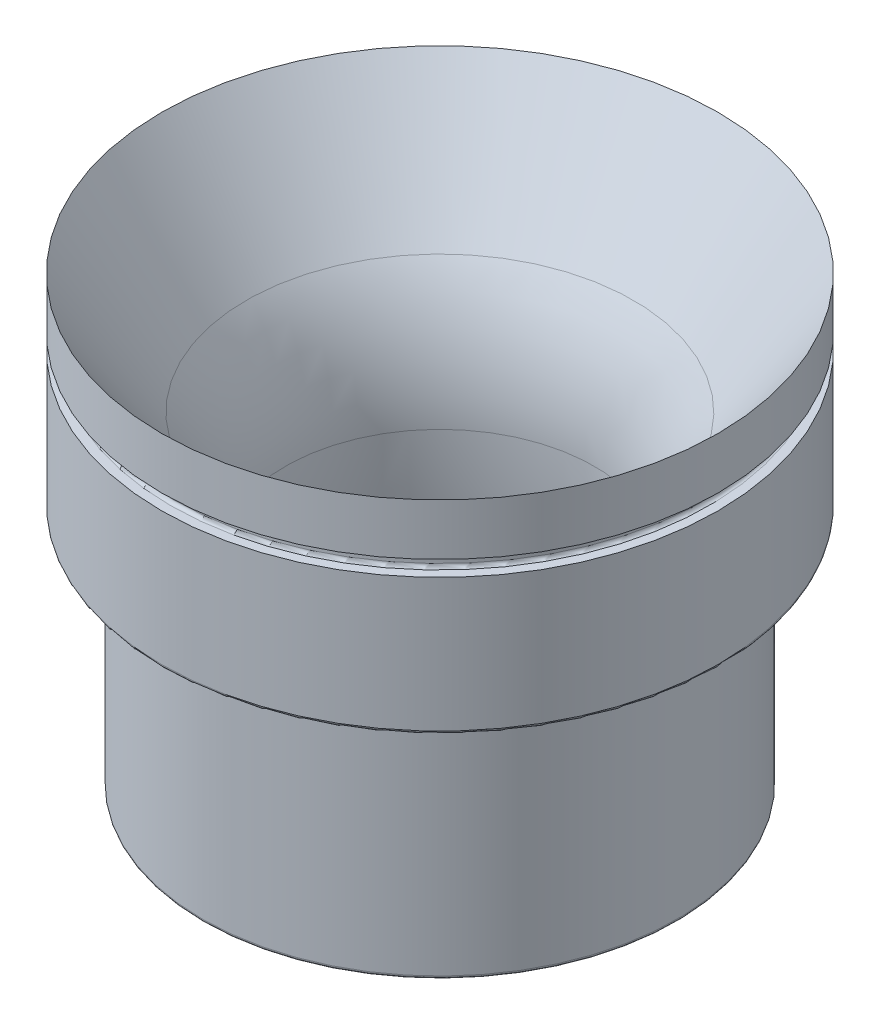
from build123d import *

# Parameters (mm, degrees)
SKETCH6_W     = 1.51765
SKETCH6_H     = 1.905
TOOL_RADIUS_R = 0.4064


with BuildPart() as part:
    # Sketch4 → Revolve1 (revolve)
    with BuildSketch(Plane(origin=(0, 0, 0), x_dir=(0, 0, -1), z_dir=(1, 0, 0)), mode=Mode.PRIVATE) as revolve1_sk:
        with BuildLine():
            Line((34.28365, 0), (23.873214979, -14.867642025))
            ThreePointArc((23.873214979, -14.867642025), (20.284368924, -22.14510191), (19.05, -30.164925582))
            ThreePointArc((19.05, -30.164925582), (19.864190646, -42.592331251), (22.292843289, -54.80727965))
            Line((22.292843289, -54.80727965), (29.1846, -54.80727965))
            Line((29.1846, -54.80727965), (29.1846, -25.059525582))
            Line((29.1846, -25.059525582), (34.28365, -25.059525582))
            Line((34.28365, -25.059525582), (34.28365, 0))
        make_face()
    revolve(revolve1_sk.sketch.rotate(Axis((0, 0, 0), (0, -1, 0)), 180), axis=Axis((0, 0, 0), (0, -1, 0)))

    # Sketch6 → Spring Groove (revolve, cut)
    with BuildSketch(Plane(origin=(0, 0, 0), x_dir=(0, 0, -1), z_dir=(1, 0, 0)), mode=Mode.PRIVATE) as spring_groove_sk:
        with Locations((33.524825, -7.3025)):
            Rectangle(SKETCH6_W, SKETCH6_H)
    revolve(spring_groove_sk.sketch.rotate(Axis((0, 11.364369063, 0), (0, -1, 0)), 180), axis=Axis((0, 11.364369063, 0), (0, -1, 0)), mode=Mode.SUBTRACT)

    # Tool Radius
    tool_radius_edges = [part.edges().sort_by_distance(p)[0] for p in [
        (0, -6.35, -32.766),
        (0, -8.255, -32.766),
        (0, -25.059525582, -34.28365),
        (0, -25.059525582, -29.1846),
        (0, -54.80727965, -29.1846),
    ]]
    fillet(tool_radius_edges, radius=TOOL_RADIUS_R)


solid = part.part
